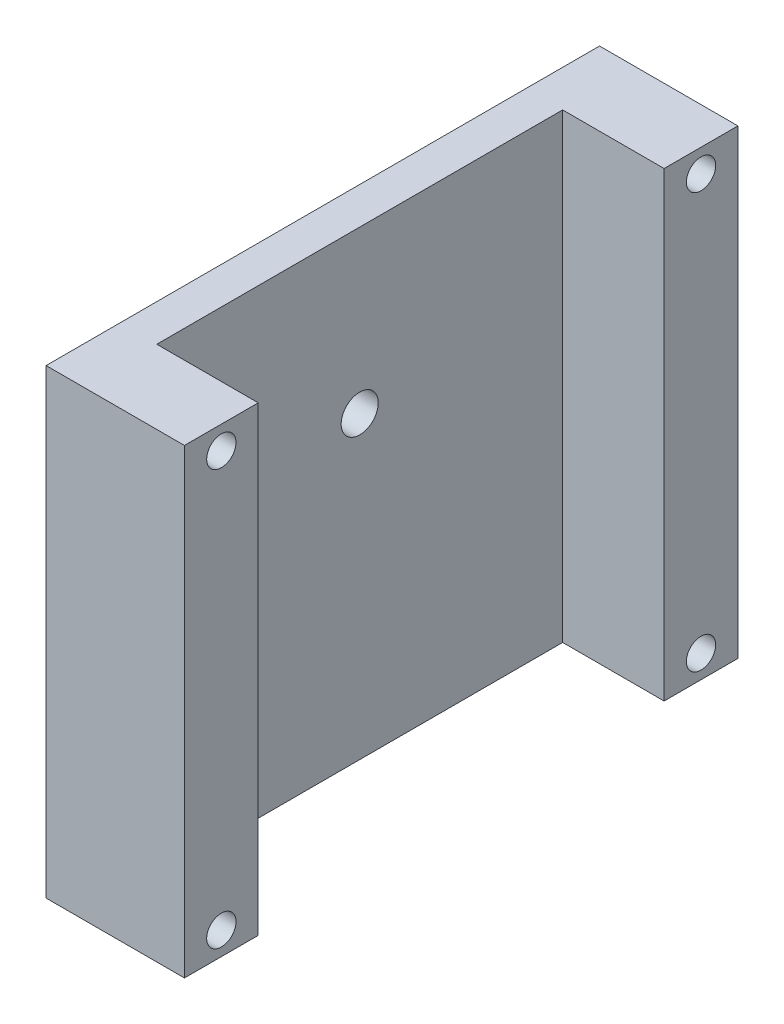
from build123d import *

# Parameters (mm, degrees)
SKETCH1_W                   = 76.2
SKETCH1_H                   = 63.5
BOSS_EXTRUDE1_DEPTH         = 19.05
SKETCH2_W                   = 55.88
SKETCH2_H                   = 63.5
CUT_EXTRUDE1_DEPTH          = 13.97
F_1_4_20_TAPPED_HOLE1_D     = 5.1054
F_1_4_20_TAPPED_HOLE1_DEPTH = 19.05
F_1_4_20_TAPPED_HOLE1_TIP   = 1.533816902
LPATTERN1_COUNT             = 2
LPATTERN1_PITCH             = 57.15
LPATTERN1_COUNT_DIR2        = 2
LPATTERN1_PITCH_DIR2        = 66.04


with BuildPart() as part:
    # Sketch1 → Boss-Extrude1 (new body)
    with BuildSketch(Plane(origin=(0, 0, 0), x_dir=(0, 0, -1), z_dir=(1, 0, 0))):
        Rectangle(SKETCH1_W, SKETCH1_H)
    extrude(amount=BOSS_EXTRUDE1_DEPTH)

    # Sketch2 → Cut-Extrude1 (cut)
    with BuildSketch(Plane(origin=(19.05, 0, 0), x_dir=(0, 0, -1), z_dir=(1, 0, 0))):
        Rectangle(SKETCH2_W, SKETCH2_H)
    extrude(amount=-CUT_EXTRUDE1_DEPTH, mode=Mode.SUBTRACT)

    # Sketch5 → #10-32 Tapped Hole1 (revolve, cut)
    with BuildSketch(Plane(origin=(19.05, 28.575, 33.02), x_dir=(0, 0, -1), z_dir=(0, 1, 0))):
        Polygon((0, 0), (0, 14.929317848), (2.0193, 13.716), (2.0193, 0), align=None)
    f_10_32_tapped_hole1 = revolve(axis=Axis((25.4, 28.575, 33.02), (-1, 0, 0)), mode=Mode.SUBTRACT)

    # 1/4-20 Tapped Hole1
    with Locations(Plane(origin=(5.08, 0, 0), x_dir=(0, 0, -1), z_dir=(1, 0, 0))):
        with Locations((0, 9.525)):
            Hole(F_1_4_20_TAPPED_HOLE1_D / 2, depth=F_1_4_20_TAPPED_HOLE1_DEPTH)
            with Locations((0, 0, -(F_1_4_20_TAPPED_HOLE1_DEPTH + F_1_4_20_TAPPED_HOLE1_TIP / 2))):  # 118° drill point
                Cone(0, F_1_4_20_TAPPED_HOLE1_D / 2, F_1_4_20_TAPPED_HOLE1_TIP, mode=Mode.SUBTRACT)

    # LPattern1: 10-32 Tapped Hole1 2 × 2
    with Locations(*[(0, -i * LPATTERN1_PITCH, -j * LPATTERN1_PITCH_DIR2) for i in range(LPATTERN1_COUNT) for j in range(LPATTERN1_COUNT_DIR2) if (i, j) != (0, 0)]):
        add(f_10_32_tapped_hole1, mode=Mode.SUBTRACT)


solid = part.part
